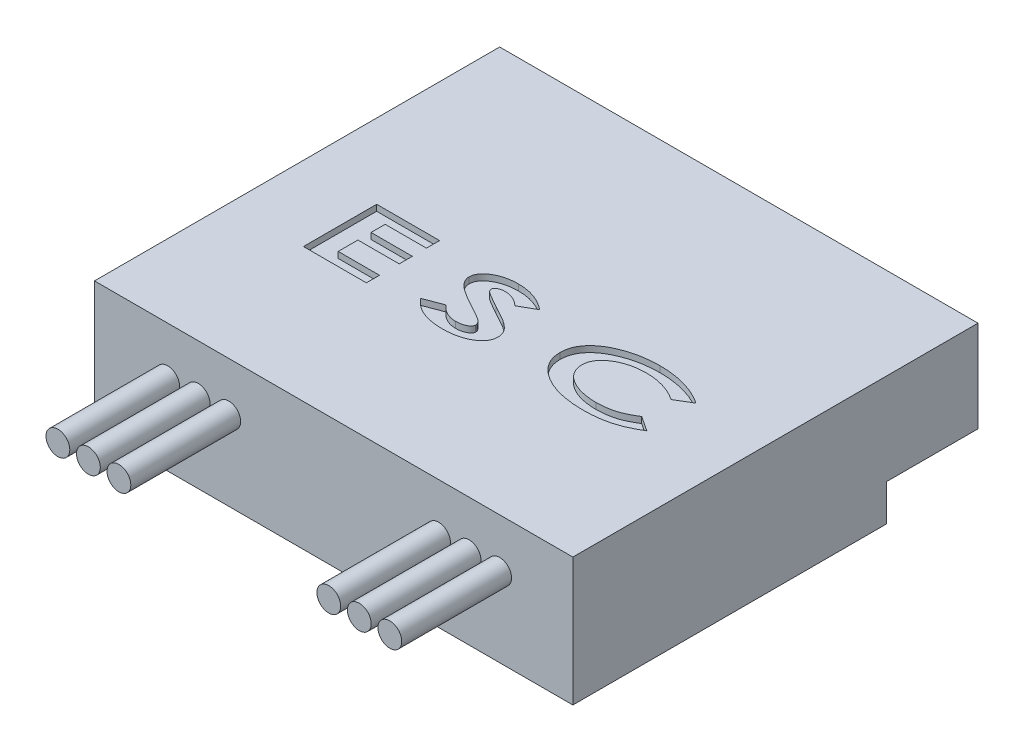
from build123d import *

# Parameters (mm, degrees)
SKETCH1_W           = 78.4
SKETCH1_H           = 66.4
BOSS_EXTRUDE1_DEPTH = 21
SKETCH2_R           = 1.95
BOSS_EXTRUDE2_DEPTH = 18
SKETCH3_W           = 32
SKETCH3_H           = 20
CUT_EXTRUDE1_DEPTH  = 10
SKETCH4_W           = 78.4
SKETCH4_H           = 15
CUT_EXTRUDE2_DEPTH  = 6
SKETCH5_R           = 1.95
BOSS_EXTRUDE6_DEPTH = 9
CUT_EXTRUDE3_DEPTH  = 1


with BuildPart() as part:
    # Sketch1 → Boss-Extrude1 (new body)
    with BuildSketch(Plane(origin=(0, 0, 0), x_dir=(1, 0, 0), z_dir=(0, 1, 0))):
        with Locations((39.2, 33.2)):
            Rectangle(SKETCH1_W, SKETCH1_H)
    extrude(amount=BOSS_EXTRUDE1_DEPTH)

    # Sketch2 → Boss-Extrude2 (add)
    with BuildSketch(Plane.XY):
        with Locations(Location((17, 13, 0), (0, 0, 180))):
            Circle(SKETCH2_R)
        with Locations(Location((12, 13, 0), (0, 0, 180))):
            Circle(SKETCH2_R)
        with Locations(Location((22, 13, 0), (0, 0, 180))):
            Circle(SKETCH2_R)
        with Locations(Location((56.4, 13, 0), (0, 0, 180))):
            Circle(SKETCH2_R)
        with Locations(Location((61.4, 13, 0), (0, 0, 180))):
            Circle(SKETCH2_R)
        with Locations(Location((66.4, 13, 0), (0, 0, 180))):
            Circle(SKETCH2_R)
    extrude(amount=BOSS_EXTRUDE2_DEPTH)

    # Sketch3 → Cut-Extrude1 (cut)
    with BuildSketch(Plane.XZ):
        with Locations((36, -41.4)):
            Rectangle(SKETCH3_W, SKETCH3_H)
    extrude(amount=-CUT_EXTRUDE1_DEPTH, mode=Mode.SUBTRACT)

    # Sketch4 → Cut-Extrude2 (cut)
    with BuildSketch(Plane.XZ):
        with Locations((39.2, -58.9)):
            Rectangle(SKETCH4_W, SKETCH4_H)
    extrude(amount=-CUT_EXTRUDE2_DEPTH, mode=Mode.SUBTRACT)

    # Sketch5 → Boss-Extrude6 (add)
    with BuildSketch(Plane.XZ.offset(-10)):
        with Locations(Location((49.05, -34.35, 0), (0, 0, 90))):
            Circle(SKETCH5_R)
        with Locations(Location((34.15, -34.35, 0), (0, 0, 90))):
            Circle(SKETCH5_R)
    extrude(amount=BOSS_EXTRUDE6_DEPTH)

    # Sketch6 → Cut-Extrude3 (cut)
    with BuildSketch(Plane(origin=(0, 21, 0), x_dir=(1, 0, 0), z_dir=(0, 1, 0))):
        Polygon((12.246153846, 34), (22.553846154, 34), (22.553846154, 31.846153846), (15.784615385, 31.846153846), (15.784615385, 29.538461538), (22.553846154, 29.538461538), (22.553846154, 27.384615385), (15.784615385, 27.384615385), (15.784615385, 24.153846154), (22.553846154, 24.153846154), (22.553846154, 22), (12.246153846, 22), align=None)
        with BuildLine():
            Line((40.584615385, 32.396634615), (37.998076923, 30.923076923))
            add(Edge.make_bspline(
                [(37.998076923, 30.923076923), (37.885756371, 31.021034785), (37.666609946, 31.212158446), (37.321604994, 31.461613742), (36.977018121, 31.675575956), (36.629604862, 31.849850713), (36.280257854, 31.985362188), (35.929288423, 32.082329213), (35.577082092, 32.142551131), (35.341254598, 32.150096025), (35.224038462, 32.153846154)],
                knots=[0, 0, 0, 0, 1.151463833, 2.246598481, 3.286540075, 4.283679302, 5.246389907, 6.177996593, 7.094388031, 8, 8, 8, 8], degree=3))
            add(Edge.make_bspline(
                [(35.224038462, 32.153846154), (35.114903254, 32.151455365), (34.905198913, 32.146861441), (34.606215465, 32.101760004), (34.337876995, 32.024575146), (34.104811143, 31.920975549), (33.913766576, 31.799790115), (33.771968055, 31.667198302), (33.677693027, 31.523164177), (33.666738299, 31.417800855), (33.661538462, 31.367788462)],
                knots=[0, 0, 0, 0, 1.383181381, 2.657796193, 3.821791152, 4.913283996, 5.882753412, 6.673190753, 7.370208683, 8, 8, 8, 8], degree=3))
            add(Edge.make_bspline(
                [(33.661538462, 31.367788462), (33.665196704, 31.31749427), (33.672712751, 31.214162289), (33.738778308, 31.065166231), (33.839111916, 30.919841971), (33.930386322, 30.837164655), (33.978846154, 30.793269231)],
                knots=[0, 0, 0, 0, 0.887965238, 1.824369859, 2.84490435, 4, 4, 4, 4], degree=3))
            add(Edge.make_bspline(
                [(33.978846154, 30.793269231), (34.023265656, 30.758187637), (34.12753533, 30.675837631), (34.32083166, 30.551303813), (34.564308794, 30.393950435), (34.865951049, 30.215899065), (35.21842574, 30.008445705), (35.627291669, 29.777784196), (36.088944648, 29.518526337), (36.416949843, 29.339387784), (36.589423077, 29.245192308)],
                knots=[0, 0, 0, 0, 0.447024127, 1.04933773, 1.815120696, 2.738070006, 3.816358118, 5.046944529, 6.447210492, 8, 8, 8, 8], degree=3))
            add(Edge.make_bspline(
                [(36.589423077, 29.245192308), (36.751345402, 29.157970045), (37.057847843, 28.992867202), (37.492199786, 28.756581462), (37.875647732, 28.545176755), (38.21064161, 28.3608086), (38.493744654, 28.199539253), (38.728010637, 28.064633893), (38.912325929, 27.956096545), (39.016661659, 27.888871974), (39.060576923, 27.860576923)],
                knots=[0, 0, 0, 0, 1.558035923, 2.949203027, 4.188692445, 5.267303, 6.188380665, 6.94865321, 7.557484549, 8, 8, 8, 8], degree=3))
            add(Edge.make_bspline(
                [(39.060576923, 27.860576923), (39.147391683, 27.802489445), (39.316811624, 27.689131105), (39.55902649, 27.517229377), (39.781583125, 27.346132727), (39.982365044, 27.176250831), (40.164562481, 27.00882367), (40.328847812, 26.844682704), (40.469519262, 26.678142604), (40.633506653, 26.465800455), (40.796937694, 26.190739683), (40.943003449, 25.844565784), (41.028963974, 25.480926483), (41.040406209, 25.232807584), (41.046153846, 25.108173077)],
                knots=[0, 0, 0, 0, 1.058886312, 2.066428072, 3.010405479, 3.903820285, 4.731645146, 5.518566705, 6.256013361, 6.939983944, 8.236938558, 9.486000467, 10.737173618, 12, 12, 12, 12], degree=3))
            add(Edge.make_bspline(
                [(41.046153846, 25.108173077), (41.042167881, 24.986711537), (41.034296517, 24.746852914), (40.95218199, 24.396806066), (40.828445776, 24.062144794), (40.648778373, 23.745685108), (40.419767011, 23.446956635), (40.14447392, 23.160347033), (39.81299228, 22.897994255), (39.440186175, 22.648404981), (39.025586367, 22.425412239), (38.578756173, 22.226295702), (38.100417412, 22.062350205), (37.591849868, 21.927207401), (37.053613136, 21.822746054), (36.484675698, 21.745847291), (35.885068457, 21.699605418), (35.474923061, 21.694779073), (35.264903846, 21.692307692)],
                knots=[0, 0, 0, 0, 0.785386359, 1.55095754, 2.316317596, 3.09009509, 3.897648887, 4.749166546, 5.656962947, 6.630003971, 7.651827797, 8.702041743, 9.795146261, 10.923103635, 12.107848954, 13.343865379, 14.639898643, 16, 16, 16, 16], degree=3))
            add(Edge.make_bspline(
                [(35.264903846, 21.692307692), (35.099795879, 21.694085106), (34.774930799, 21.69758233), (34.295331441, 21.727271675), (33.831685659, 21.774683942), (33.384011333, 21.841809933), (32.9531256, 21.928162624), (32.538942508, 22.03364727), (32.141074592, 22.159299492), (31.758125462, 22.302396401), (31.390879128, 22.469764472), (31.036916463, 22.657654609), (30.695490481, 22.865735987), (30.368863664, 23.099220685), (30.055357528, 23.352415196), (29.755256205, 23.62876256), (29.468668862, 23.926683139), (29.290123601, 24.139947518), (29.2, 24.247596154)],
                knots=[0, 0, 0, 0, 1.160736759, 2.283856113, 3.37695986, 4.436612623, 5.465215934, 6.46539501, 7.440004787, 8.397398946, 9.337802332, 10.27529885, 11.213472188, 12.146693455, 13.096031512, 14.04495159, 15.013157774, 16, 16, 16, 16], degree=3))
            Line((29.2, 24.247596154), (32.207211538, 25.384615385))
            add(Edge.make_bspline(
                [(32.207211538, 25.384615385), (32.320427325, 25.262250079), (32.541309011, 25.023517871), (32.902047301, 24.70937372), (33.275489414, 24.443273217), (33.662017105, 24.22504622), (34.061048949, 24.05513083), (34.473172393, 23.934340188), (34.898409034, 23.859724689), (35.18687913, 23.850700347), (35.332211538, 23.846153846)],
                knots=[0, 0, 0, 0, 1.112264183, 2.170004676, 3.18669602, 4.168670381, 5.127423448, 6.075296164, 7.030326369, 8, 8, 8, 8], degree=3))
            add(Edge.make_bspline(
                [(35.332211538, 23.846153846), (35.479931561, 23.849894217), (35.764885776, 23.857109449), (36.172905491, 23.923666464), (36.546409656, 24.02669006), (36.825032204, 24.155889477), (37.024566431, 24.271764276), (37.152043931, 24.363346962), (37.261905275, 24.457065137), (37.351843687, 24.555001237), (37.419525948, 24.658142822), (37.472587587, 24.761916671), (37.50189142, 24.871818708), (37.505764231, 24.946161547), (37.507692308, 24.983173077)],
                knots=[0, 0, 0, 0, 1.994868064, 3.848131422, 5.572077196, 7.214799191, 7.981806503, 8.688002326, 9.332834679, 9.930870741, 10.477480229, 10.995677587, 11.499998792, 12, 12, 12, 12], degree=3))
            add(Edge.make_bspline(
                [(37.507692308, 24.983173077), (37.501967842, 25.05221199), (37.490061386, 25.195807718), (37.39109078, 25.404405267), (37.240746933, 25.611087906), (37.068547636, 25.777554796), (36.893047186, 25.917597979), (36.721515298, 26.039399736), (36.515131519, 26.176410716), (36.271605257, 26.323952346), (35.994704119, 26.48803648), (35.682576198, 26.665916069), (35.333720411, 26.854685084), (35.089494905, 26.984911684), (34.962019231, 27.052884615)],
                knots=[0, 0, 0, 0, 0.728698247, 1.515637342, 2.403756357, 3.430192616, 4.04002485, 4.782098419, 5.657921285, 6.663935966, 7.798033462, 9.067831563, 10.469528622, 12, 12, 12, 12], degree=3))
            add(Edge.make_bspline(
                [(34.962019231, 27.052884615), (34.837735472, 27.118429583), (34.593587514, 27.247188724), (34.237017548, 27.438717484), (33.89698352, 27.624107163), (33.574637764, 27.804044834), (33.269718891, 27.980779897), (32.978865105, 28.147144085), (32.706757213, 28.311261788), (32.452590932, 28.470171104), (32.213665143, 28.620996544), (31.993267091, 28.768038345), (31.788071722, 28.907049943), (31.600331042, 29.041492509), (31.430323754, 29.171463425), (31.275325124, 29.293571701), (31.138924619, 29.41145177), (30.979572787, 29.556695663), (30.80840176, 29.738174572), (30.625234503, 29.955335747), (30.471654343, 30.173339554), (30.344480871, 30.391764434), (30.245549935, 30.609890966), (30.174533352, 30.82820696), (30.132187939, 31.046434803), (30.126098389, 31.192132115), (30.123076923, 31.264423077)],
                knots=[0, 0, 0, 0, 1.515528176, 2.977163822, 4.365653063, 5.692832444, 6.958859938, 8.167012862, 9.306831529, 10.3860253, 11.400206339, 12.354234696, 13.243591416, 14.073468891, 14.844413536, 15.55168912, 16.201329095, 16.788522835, 17.876608653, 18.889131178, 19.850646507, 20.748986645, 21.611611138, 22.428835989, 23.220432031, 24, 24, 24, 24], degree=3))
            add(Edge.make_bspline(
                [(30.123076923, 31.264423077), (30.127999886, 31.367340041), (30.137759797, 31.571375754), (30.207239687, 31.872010969), (30.324269932, 32.160085271), (30.487629046, 32.436617364), (30.697879904, 32.700089475), (30.952001586, 32.953095933), (31.252560852, 33.193469863), (31.594375142, 33.418956141), (31.969478944, 33.626796024), (32.370637886, 33.809055778), (32.794350536, 33.963347457), (33.23852189, 34.090381179), (33.704407665, 34.188992258), (34.191073415, 34.258077826), (34.699288578, 34.299158398), (35.045276054, 34.304811022), (35.221634615, 34.307692308)],
                knots=[0, 0, 0, 0, 0.758500524, 1.503748172, 2.261811434, 3.043002738, 3.863249088, 4.740510202, 5.681611051, 6.695858962, 7.7562691, 8.840230686, 9.941061797, 11.077968674, 12.24361496, 13.449222666, 14.699804323, 16, 16, 16, 16], degree=3))
            add(Edge.make_bspline(
                [(35.221634615, 34.307692308), (35.450225116, 34.30257299), (35.903096957, 34.29243086), (36.574119306, 34.212472827), (37.228955472, 34.086895994), (37.762759439, 33.934880102), (38.18633963, 33.784725963), (38.51069474, 33.650291694), (38.840312111, 33.491437463), (39.179678053, 33.318945277), (39.520628001, 33.115491315), (39.871902882, 32.898708359), (40.228145036, 32.657259641), (40.464150179, 32.484709956), (40.584615385, 32.396634615)],
                knots=[0, 0, 0, 0, 1.417403089, 2.808086709, 4.18525207, 5.549154529, 6.245490142, 6.971823622, 7.725409129, 8.51447216, 9.331869066, 10.186835609, 11.074498045, 12, 12, 12, 12], degree=3))
        make_face()
        with BuildLine():
            Line((66.615384615, 31.918269231), (64.088942308, 30.408653846))
            add(Edge.make_bspline(
                [(64.088942308, 30.408653846), (63.87300442, 30.548213961), (63.443257929, 30.82595804), (62.766135757, 31.181256193), (62.068015004, 31.478771924), (61.352909704, 31.729791675), (60.614781313, 31.917868859), (59.858307465, 32.055360731), (59.081241024, 32.139559803), (58.556298937, 32.149048338), (58.290865385, 32.153846154)],
                knots=[0, 0, 0, 0, 1.003411825, 1.996929369, 2.980706796, 3.964091218, 4.952730901, 5.951063266, 6.963968465, 8, 8, 8, 8], degree=3))
            add(Edge.make_bspline(
                [(58.290865385, 32.153846154), (58.06880342, 32.150025077), (57.631993019, 32.142508769), (56.990293547, 32.087156784), (56.375389179, 31.993117161), (55.786894631, 31.864446668), (55.226194021, 31.695914992), (54.691434837, 31.491037501), (54.184096473, 31.248409043), (53.709003945, 30.971760979), (53.275148732, 30.669206483), (52.89346424, 30.34556571), (52.569890027, 30.003198334), (52.307677465, 29.641372842), (52.099547519, 29.263527003), (51.951958109, 28.866105005), (51.862339553, 28.450310532), (51.851586186, 28.167106345), (51.846153846, 28.024038462)],
                knots=[0, 0, 0, 0, 1.262985275, 2.484374611, 3.660079835, 4.799045536, 5.907857675, 6.987021196, 8.05317154, 9.102976971, 10.110714631, 11.057876149, 11.944598432, 12.783310729, 13.592989677, 14.390467818, 15.1869034, 16, 16, 16, 16], degree=3))
            add(Edge.make_bspline(
                [(51.846153846, 28.024038462), (51.848208009, 27.92374772), (51.852266308, 27.725608725), (51.892368379, 27.432702372), (51.956576041, 27.148394168), (52.049005036, 26.873620835), (52.164878012, 26.606981229), (52.307665, 26.348864889), (52.476400383, 26.099241488), (52.668722483, 25.85829325), (52.886046903, 25.630237356), (53.124684236, 25.413362345), (53.385277561, 25.209032533), (53.666537781, 25.016095838), (53.97059286, 24.839432252), (54.294131089, 24.671961838), (54.640073494, 24.519968844), (55.004212008, 24.377165715), (55.386292258, 24.254305605), (55.779354232, 24.142472104), (56.184100229, 24.051859123), (56.598159485, 23.978276252), (57.021962323, 23.916138129), (57.457018324, 23.877983141), (57.902647706, 23.848731925), (58.203473927, 23.847020345), (58.355769231, 23.846153846)],
                knots=[0, 0, 0, 0, 0.842222792, 1.663934032, 2.478888028, 3.287897145, 4.095897172, 4.918518041, 5.762514897, 6.624682586, 7.50570125, 8.40645995, 9.331742352, 10.28596337, 11.269723232, 12.284441101, 13.345344079, 14.443055421, 15.56929938, 16.716022723, 17.875638069, 19.052267978, 20.249064262, 21.472991362, 22.72068483, 24, 24, 24, 24], degree=3))
            add(Edge.make_bspline(
                [(58.355769231, 23.846153846), (58.612330177, 23.850830768), (59.115206579, 23.859997844), (59.85200859, 23.930004279), (60.554696886, 24.048255744), (61.119949093, 24.18464352), (61.563798741, 24.323243813), (61.900730094, 24.448802715), (62.246893486, 24.591958008), (62.6010899, 24.751800607), (62.963445701, 24.933229089), (63.33183382, 25.135760003), (63.710379926, 25.353706204), (63.961242396, 25.511183406), (64.088942308, 25.591346154)],
                knots=[0, 0, 0, 0, 1.516976175, 2.973373506, 4.371611262, 5.727674641, 6.408036713, 7.120113576, 7.853086913, 8.622857311, 9.4174839, 10.248663143, 11.108493339, 12, 12, 12, 12], degree=3))
            Line((64.088942308, 25.591346154), (66.538461538, 23.983173077))
            add(Edge.make_bspline(
                [(66.538461538, 23.983173077), (66.365955855, 23.878846005), (66.026156395, 23.67334389), (65.514001532, 23.386098746), (65.006247577, 23.12846876), (64.509328425, 22.888372476), (64.018590112, 22.676411278), (63.533493153, 22.491633826), (63.05719306, 22.327096323), (62.582645693, 22.189383396), (62.104853698, 22.070016023), (61.613705168, 21.970240269), (61.106462004, 21.882750919), (60.582611476, 21.814614389), (60.042490258, 21.757972518), (59.485967642, 21.721353216), (58.912904175, 21.695570248), (58.525671294, 21.693405378), (58.329326923, 21.692307692)],
                knots=[0, 0, 0, 0, 1.118438233, 2.20308514, 3.256818268, 4.276863967, 5.26452522, 6.221392251, 7.156269007, 8.059416584, 8.961863673, 9.887766084, 10.839320799, 11.816976726, 12.818003825, 13.851809192, 14.910771286, 16, 16, 16, 16], degree=3))
            add(Edge.make_bspline(
                [(58.329326923, 21.692307692), (58.147409973, 21.693591246), (57.788253127, 21.696125352), (57.256096164, 21.719309883), (56.73655866, 21.751724941), (56.229134198, 21.800084051), (55.734358097, 21.861754486), (55.252176286, 21.940316217), (54.781494283, 22.026580935), (54.324535406, 22.13463469), (53.879577289, 22.250412543), (53.448353725, 22.384931393), (53.027344188, 22.52627219), (52.620811516, 22.690150403), (52.224268277, 22.861257007), (51.841501758, 23.048804907), (51.473325246, 23.25277724), (51.115964617, 23.463526631), (50.778454731, 23.690786838), (50.457461945, 23.921669803), (50.162866463, 24.166015805), (49.88645226, 24.413320451), (49.633617422, 24.671123778), (49.403363539, 24.937024845), (49.195125098, 25.211123235), (49.006863626, 25.490983683), (48.844054015, 25.781573779), (48.698166403, 26.076502452), (48.577924857, 26.38152432), (48.479370422, 26.694059874), (48.402513384, 27.014580467), (48.346477912, 27.342099471), (48.315713106, 27.678096257), (48.310387764, 27.904589665), (48.307692308, 28.019230769)],
                knots=[0, 0, 0, 0, 1.329992908, 2.625791924, 3.893880564, 5.135562183, 6.351985201, 7.538585754, 8.707130173, 9.84970056, 10.970893333, 12.067948984, 13.151769263, 14.216822402, 15.271496693, 16.309044676, 17.331598402, 18.348379459, 19.341164166, 20.305557419, 21.237959297, 22.138052634, 23.016317951, 23.876079758, 24.708005681, 25.531805757, 26.339852461, 27.141609607, 27.935775141, 28.734358188, 29.535772794, 30.343840735, 31.161724267, 32, 32, 32, 32], degree=3))
            add(Edge.make_bspline(
                [(48.307692308, 28.019230769), (48.311217979, 28.166857921), (48.318222497, 28.46015159), (48.379410423, 28.89277742), (48.482164809, 29.312281734), (48.620322874, 29.719863145), (48.803983738, 30.11349107), (49.021139625, 30.49685697), (49.284860802, 30.864176558), (49.585300703, 31.218789364), (49.92150986, 31.561044928), (50.29713266, 31.882291771), (50.702736999, 32.191026481), (51.144877966, 32.478915643), (51.619783334, 32.751409499), (52.130053227, 33.005192996), (52.674711061, 33.243611328), (53.250244913, 33.462339076), (53.848305517, 33.661276784), (54.461961449, 33.834445631), (55.08690423, 33.980464931), (55.723369292, 34.102347723), (56.371985432, 34.191221136), (57.030815603, 34.260316199), (57.701476688, 34.298213361), (58.152200796, 34.304511746), (58.379807692, 34.307692308)],
                knots=[0, 0, 0, 0, 0.811914704, 1.613046369, 2.397855704, 3.185532293, 3.976520402, 4.784139167, 5.606140154, 6.460156103, 7.339234317, 8.242486197, 9.177080603, 10.141798575, 11.142984495, 12.187881182, 13.275581126, 14.412789894, 15.574045434, 16.742142353, 17.91945334, 19.103964216, 20.305966926, 21.520163223, 22.747730726, 24, 24, 24, 24], degree=3))
            add(Edge.make_bspline(
                [(58.379807692, 34.307692308), (58.573755711, 34.305870836), (58.96026285, 34.302240938), (59.536688149, 34.272206926), (60.108558168, 34.225315163), (60.674180859, 34.153857476), (61.235265141, 34.069626845), (61.789239431, 33.958582448), (62.33943611, 33.836234222), (62.880783039, 33.688388626), (63.411279662, 33.526449859), (63.924803537, 33.345546707), (64.421794324, 33.152409397), (64.896965463, 32.937021778), (65.355135555, 32.709624637), (65.793241408, 32.463020638), (66.21502352, 32.20280632), (66.482548304, 32.012676149), (66.615384615, 31.918269231)],
                knots=[0, 0, 0, 0, 1.068584379, 2.129516431, 3.179598852, 4.229384225, 5.270293654, 6.305004903, 7.341786329, 8.375291202, 9.396157633, 10.397319724, 11.374599434, 12.333028154, 13.270898372, 14.192023212, 15.102270213, 16, 16, 16, 16], degree=3))
        make_face()
    extrude(amount=-CUT_EXTRUDE3_DEPTH, mode=Mode.SUBTRACT)


solid = part.part
